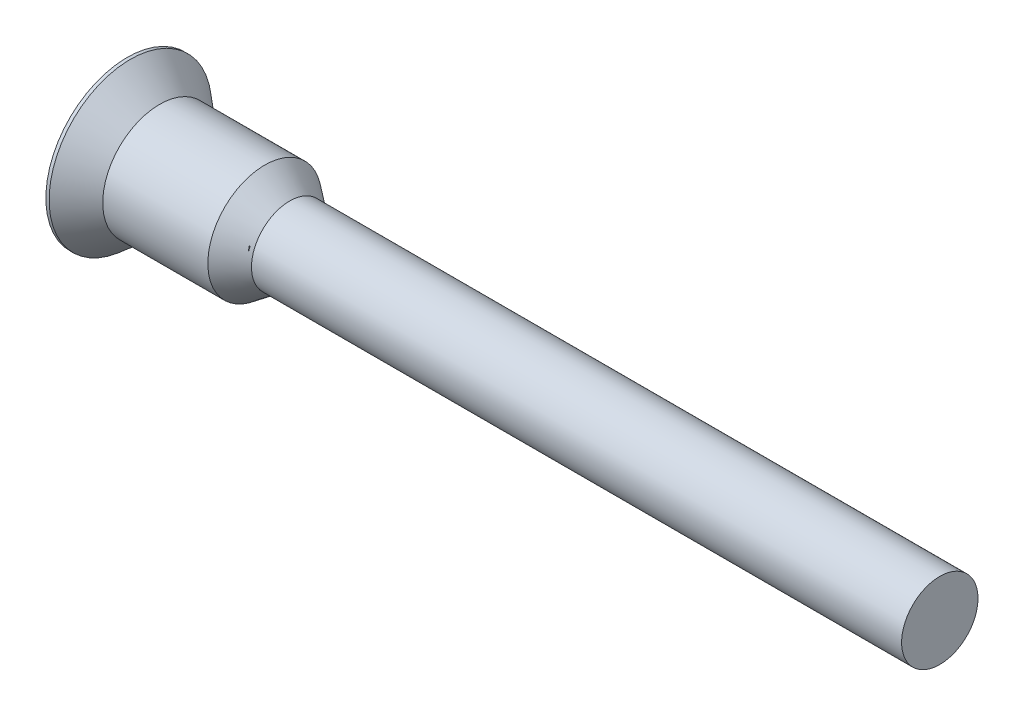
from build123d import *

# Parameters (mm, degrees)
CUT_EXTRUDE1_DEPTH     = 2
CUT_SWEEP6_PITCH       = 1.62
CUT_SWEEP6_HEIGHT      = 40
CUT_SWEEP6_RADIUS      = 3.5
CUT_SWEEP6_START_ANGLE = -45


with BuildPart() as part:
    # Sketch1 → Revolve1 (revolve)
    with BuildSketch(Plane(origin=(0, 0, 0), x_dir=(1, 0, 0), z_dir=(0, 1, 0))):
        Polygon((0, 0), (0, 5), (0.2, 5), (2, 3.5), (8.466666667, 3.5), (10, 2.35), (50, 2.35), (50, 0), align=None)
    revolve(axis=Axis((50, 0, 0), (-1, 0, 0)))

    # Sketch2 → Cut-Extrude1 (cut)
    with BuildSketch(Plane.ZY):
        Polygon((1.987284991, 1.176448765), (-0.025192021, 2.30926367), (-2.012477012, 1.132814905), (-1.987284991, -1.176448765), (0.025192021, -2.30926367), (2.012477012, -1.132814905), align=None)
    extrude(amount=-CUT_EXTRUDE1_DEPTH, mode=Mode.SUBTRACT)

    # Cut-Sweep6: sweep along a helix
    with BuildLine() as cut_sweep6_path:
        add(Helix(CUT_SWEEP6_PITCH, CUT_SWEEP6_HEIGHT, CUT_SWEEP6_RADIUS, center=(50, 0, 0), direction=(-1, 0, 0), mode=Mode.PRIVATE).rotate(Axis((50, 0, 0), (-1, 0, 0)), CUT_SWEEP6_START_ANGLE))
    # Sketch6 → Cut-Sweep6 (sweep, cut)
    with BuildSketch(Plane(origin=(0, 0, 0), x_dir=(1, 0, 0), z_dir=(0, 1, 0))):
        Polygon((50, 2.474873734), (49.595000005, 2.474873734), (49.797500002, 3.500000136), align=None)
    sweep(path=cut_sweep6_path.line, is_frenet=True, mode=Mode.SUBTRACT)


solid = part.part
